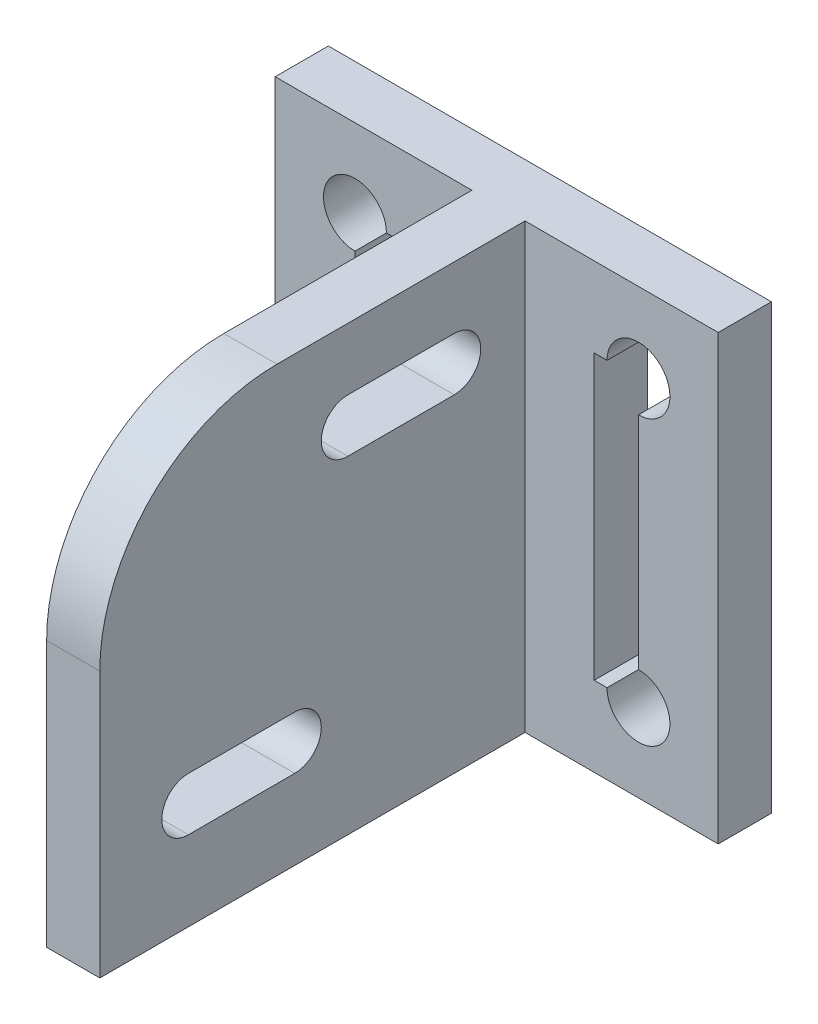
from build123d import *

# Parameters (mm, degrees)
ESQUISSE1_W             = 25
ESQUISSE1_H             = 25
BOSS_EXTRU_1_DEPTH      = 3
ESQUISSE4_R             = 1.775
ESQUISSE4_W             = 2.5
ESQUISSE4_H             = 16
ENL_V_MAT_EXTRU_1_DEPTH = 10
ESQUISSE5_W             = 3
ESQUISSE5_H             = 25
BOSS_EXTRU_3_DEPTH      = 24
ENL_V_MAT_EXTRU_2_DEPTH = 10
CONG_1_R                = 10


with BuildPart() as part:
    # Esquisse1 → Boss.-Extru.1 (new body)
    with BuildSketch(Plane.XY):
        with Locations((12.5, 12.5)):
            Rectangle(ESQUISSE1_W, ESQUISSE1_H)
    extrude(amount=BOSS_EXTRU_1_DEPTH)

    # Esquisse4 → Enlèv. mat.-Extru.1 (cut)
    with BuildSketch(Plane(origin=(0, 0, 0), x_dir=(-1, 0, 0), z_dir=(0, 0, -1))):
        with BuildLine():
            Line((-20.5, 6.275), (-20.5, 4.5))
            Line((-20.5, 4.5), (-18.725, 4.5))
            ThreePointArc((-18.725, 4.5), (-19.244885463, 5.755114537), (-20.5, 6.275))
        make_face()
        with BuildLine():
            Line((-18.725, 4.5), (-20.5, 4.5))
            Line((-20.5, 4.5), (-20.5, 6.275))
            ThreePointArc((-20.5, 6.275), (-21.755114537, 3.244885463), (-18.725, 4.5))
        make_face()
        with Locations((-20.5, 20.5)):
            Circle(ESQUISSE4_R)
        with Locations((-20.5, 4.5)):
            Circle(ESQUISSE4_R)
        with Locations((-19.25, 12.5)):
            Rectangle(ESQUISSE4_W, ESQUISSE4_H)
        with BuildLine():
            ThreePointArc((-18.725, 20.5), (-21.755114537, 21.755114537), (-20.5, 18.725))
            Line((-20.5, 18.725), (-20.5, 20.5))
            Line((-20.5, 20.5), (-18.725, 20.5))
        make_face()
        with BuildLine():
            Line((-20.5, 20.5), (-20.5, 18.725))
            ThreePointArc((-20.5, 18.725), (-19.244885463, 19.244885463), (-18.725, 20.5))
            Line((-18.725, 20.5), (-20.5, 20.5))
        make_face()
        with BuildLine():
            Line((-4.5, 18.725), (-4.5, 20.5))
            Line((-4.5, 20.5), (-6.275, 20.5))
            ThreePointArc((-6.275, 20.5), (-5.755114537, 19.244885463), (-4.5, 18.725))
        make_face()
        with BuildLine():
            Line((-6.275, 20.5), (-4.5, 20.5))
            Line((-4.5, 20.5), (-4.5, 18.725))
            ThreePointArc((-4.5, 18.725), (-3.244885463, 19.244885463), (-2.725, 20.5))
            ThreePointArc((-2.725, 20.5), (-4.5, 22.275), (-6.275, 20.5))
        make_face()
        with Locations((-4.5, 4.5)):
            Circle(ESQUISSE4_R)
        with Locations((-4.5, 20.5)):
            Circle(ESQUISSE4_R)
        with Locations((-5.75, 12.5)):
            Rectangle(ESQUISSE4_W, ESQUISSE4_H)
        with BuildLine():
            ThreePointArc((-2.725, 4.5), (-3.244885463, 5.755114537), (-4.5, 6.275))
            Line((-4.5, 6.275), (-4.5, 4.5))
            Line((-4.5, 4.5), (-6.275, 4.5))
            ThreePointArc((-6.275, 4.5), (-4.5, 2.725), (-2.725, 4.5))
        make_face()
        with BuildLine():
            Line((-4.5, 4.5), (-4.5, 6.275))
            ThreePointArc((-4.5, 6.275), (-5.755114537, 5.755114537), (-6.275, 4.5))
            Line((-6.275, 4.5), (-4.5, 4.5))
        make_face()
    extrude(amount=-ENL_V_MAT_EXTRU_1_DEPTH, mode=Mode.SUBTRACT)

    # Esquisse5 → Boss.-Extru.3 (add)
    with BuildSketch(Plane.XY.offset(3)):
        with Locations((12.6, 12.5)):
            Rectangle(ESQUISSE5_W, ESQUISSE5_H)
    extrude(amount=BOSS_EXTRU_3_DEPTH)

    # Esquisse6 → Enlèv. mat.-Extru.2 (cut)
    with BuildSketch(Plane(origin=(14.1, 0, 0), x_dir=(0, 0, -1), z_dir=(1, 0, 0))):
        with BuildLine():
            Line((-22, 7.5), (-16, 7.5))
            ThreePointArc((-16, 7.5), (-14.5, 6), (-16, 4.5))
            Line((-16, 4.5), (-22, 4.5))
            ThreePointArc((-22, 4.5), (-23.5, 6), (-22, 7.5))
        make_face()
        with BuildLine():
            Line((-7, 18.5), (-13, 18.5))
            ThreePointArc((-13, 18.5), (-14.5, 20), (-13, 21.5))
            Line((-13, 21.5), (-7, 21.5))
            ThreePointArc((-7, 21.5), (-5.5, 20), (-7, 18.5))
        make_face()
    extrude(amount=-ENL_V_MAT_EXTRU_2_DEPTH, mode=Mode.SUBTRACT)

    # Congé1
    cong_1_edges = [part.edges().sort_by_distance(p)[0] for p in [
        (12.6, 25, 27),
    ]]
    fillet(cong_1_edges, radius=CONG_1_R)


solid = part.part
